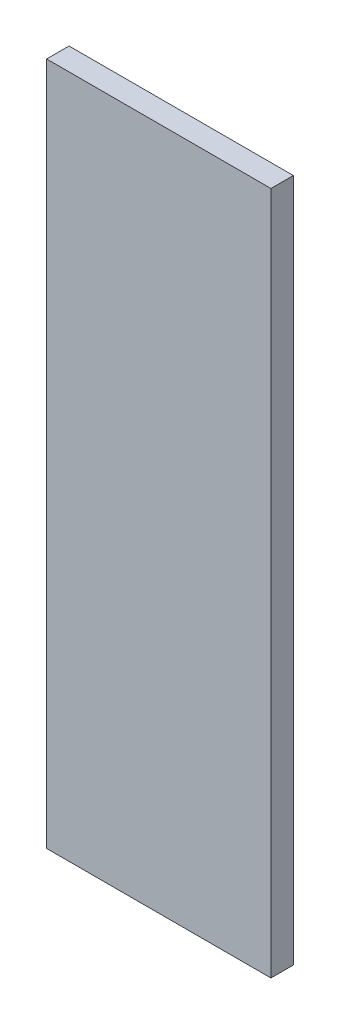
from build123d import *

# Parameters (mm, degrees)
SKETCH1_W           = 100
SKETCH1_H           = 304.8
BOSS_EXTRUDE1_DEPTH = 10


with BuildPart() as part:
    # Sketch1 → Boss-Extrude1 (new body)
    with BuildSketch(Plane.XY):
        with Locations((50, 152.4)):
            Rectangle(SKETCH1_W, SKETCH1_H)
    extrude(amount=BOSS_EXTRUDE1_DEPTH)


solid = part.part
